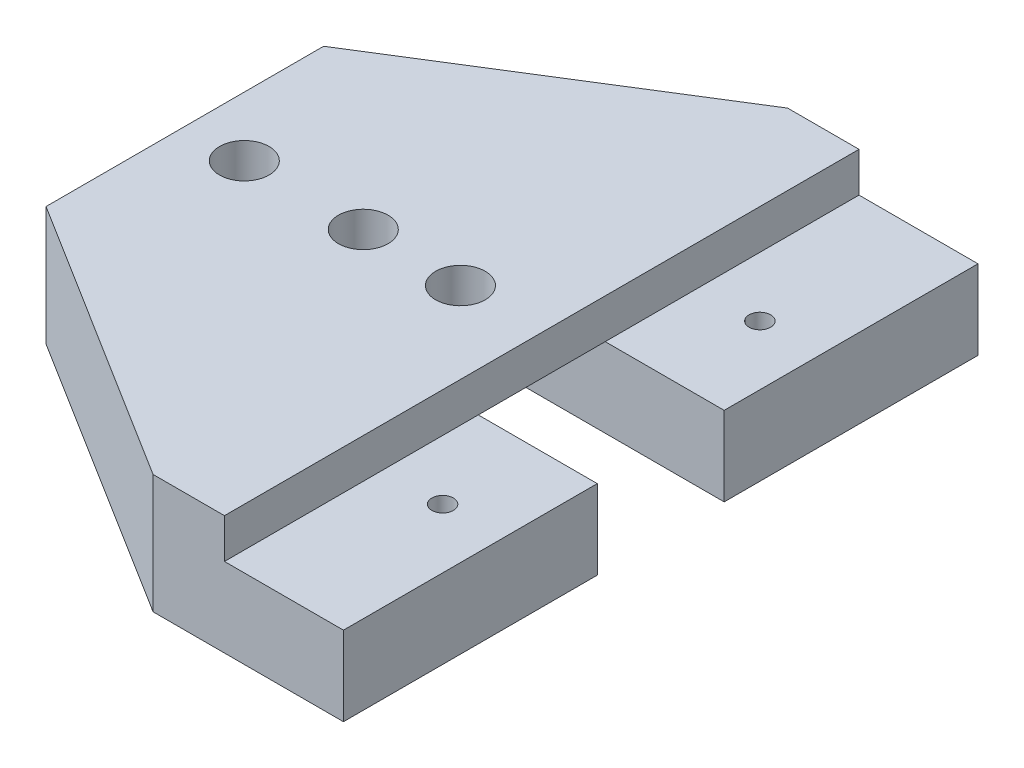
from build123d import *

# Parameters (mm, degrees)
BOSS_EXTRUDE1_DEPTH            = 9.525
SKETCH2_W                      = 76.2
SKETCH2_H                      = 20.32
CUT_EXTRUDE1_DEPTH             = 12.7
SKETCH3_W                      = 19.05
SKETCH3_H                      = 101.6
CUT_EXTRUDE2_DEPTH             = 6.35
F_5_16_0_3125_DIAMETER_HOLE1_D = 7.9375
F_8_32_TAPPED_HOLE1_D          = 3.4544


with BuildPart() as part:
    # Sketch1 → Boss-Extrude1 (new, symmetric)
    with BuildSketch(Plane(origin=(0, 0, 0), x_dir=(1, 0, 0), z_dir=(0, 1, 0))):
        Polygon((-60.96, 22.225), (-60.96, -22.225), (-15.24, -50.8), (15.24, -50.8), (15.24, 50.8), (-15.24, 50.8), align=None)
    extrude(amount=BOSS_EXTRUDE1_DEPTH, both=True)

    # Sketch2 → Cut-Extrude1 (cut)
    with BuildSketch(Plane.XZ.offset(9.525)):
        with Locations((-22.86, 0)):
            Rectangle(SKETCH2_W, SKETCH2_H)
    extrude(amount=-CUT_EXTRUDE1_DEPTH, mode=Mode.SUBTRACT)

    # Sketch3 → Cut-Extrude2 (cut)
    with BuildSketch(Plane(origin=(0, 9.525, 0), x_dir=(1, 0, 0), z_dir=(0, 1, 0))):
        with Locations((5.715, 0)):
            Rectangle(SKETCH3_W, SKETCH3_H)
    extrude(amount=-CUT_EXTRUDE2_DEPTH, mode=Mode.SUBTRACT)

    # 5/16 (0.3125) Diameter Hole1 (through all)
    with Locations(Plane(origin=(0, 9.525, 0), x_dir=(1, 0, 0), z_dir=(0, 1, 0))):
        with Locations((-51.435, 0), (-32.385, 0), (-16.8275, 0)):
            Hole(F_5_16_0_3125_DIAMETER_HOLE1_D / 2)

    # #8-32 Tapped Hole1 (through all)
    with Locations(Plane(origin=(0, -9.525, 0), x_dir=(-1, 0, 0), z_dir=(0, -1, 0))):
        with Locations((-5.715, -25.4), (-5.715, 25.4)):
            Hole(F_8_32_TAPPED_HOLE1_D / 2)


solid = part.part
